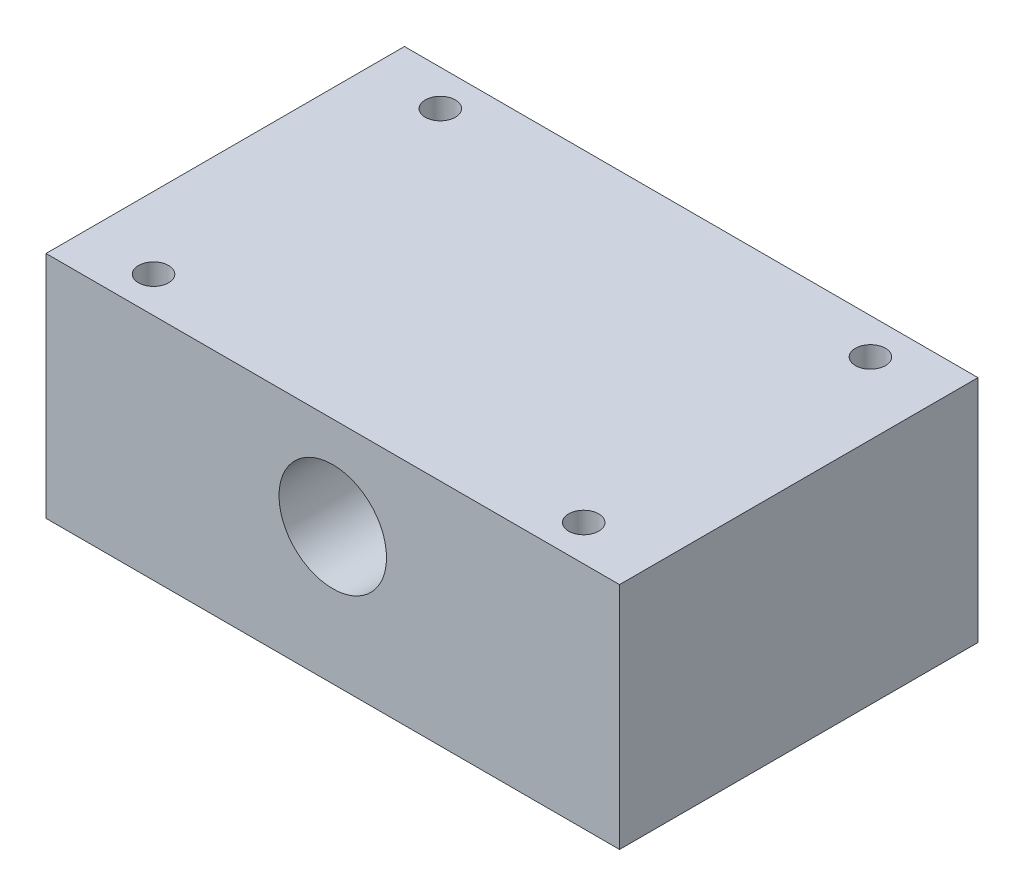
from build123d import *

# Parameters (mm, degrees)
SKETCH_1_W               = 80
SKETCH_1_H               = 50
EXTRUDE_1_DEPTH          = 32
CUT_EXTRUDE_1_DEPTH      = 72.582120673
CUT_EXTRUDE_1_DEPTH_BACK = 72.582120673
SKETCH_2_R               = 7.5
HOLE_WIZARD_M5_1_D       = 4.2
HOLE_WIZARD_M5_1_DEPTH   = 11.1381927
HOLE_WIZARD_M5_1_TIP     = 1.2618073
HOLE_WIZARD_M4_1_D       = 3.3
HOLE_WIZARD_M4_1_DEPTH   = 9.108579979
HOLE_WIZARD_M4_1_TIP     = 0.991420021


with BuildPart() as part:
    # 草图1 → 凸台-拉伸1 (new body)
    with BuildSketch(Plane(origin=(0, 0, 0), x_dir=(1, 0, 0), z_dir=(0, 1, 0))):
        Rectangle(SKETCH_1_W, SKETCH_1_H)
    extrude(amount=EXTRUDE_1_DEPTH)

    # 草图2 → 切除-拉伸1 (cut, two sides: drawn at the far end of the back side and taken through both)
    with BuildSketch(Plane.XY.offset(25).offset(-CUT_EXTRUDE_1_DEPTH_BACK)):
        with Locations((0, 19)):
            Circle(SKETCH_2_R)
    extrude(amount=CUT_EXTRUDE_1_DEPTH + CUT_EXTRUDE_1_DEPTH_BACK, mode=Mode.SUBTRACT)

    # M5 螺纹孔1
    with Locations(Plane(origin=(0, 32, 0), x_dir=(1, 0, 0), z_dir=(0, 1, 0))):
        with Locations((-30, 20), (30, 20), (30, -20), (-30, -20)):
            Hole(HOLE_WIZARD_M5_1_D / 2, depth=HOLE_WIZARD_M5_1_DEPTH)
            with Locations((0, 0, -(HOLE_WIZARD_M5_1_DEPTH + HOLE_WIZARD_M5_1_TIP / 2))):  # 118° drill point
                Cone(0, HOLE_WIZARD_M5_1_D / 2, HOLE_WIZARD_M5_1_TIP, mode=Mode.SUBTRACT)

    # M4 螺纹孔1
    with Locations(Plane.ZY.offset(40)):
        with Locations((-15, 27), (15, 27)):
            Hole(HOLE_WIZARD_M4_1_D / 2, depth=HOLE_WIZARD_M4_1_DEPTH)
            with Locations((0, 0, -(HOLE_WIZARD_M4_1_DEPTH + HOLE_WIZARD_M4_1_TIP / 2))):  # 118° drill point
                Cone(0, HOLE_WIZARD_M4_1_D / 2, HOLE_WIZARD_M4_1_TIP, mode=Mode.SUBTRACT)


solid = part.part
